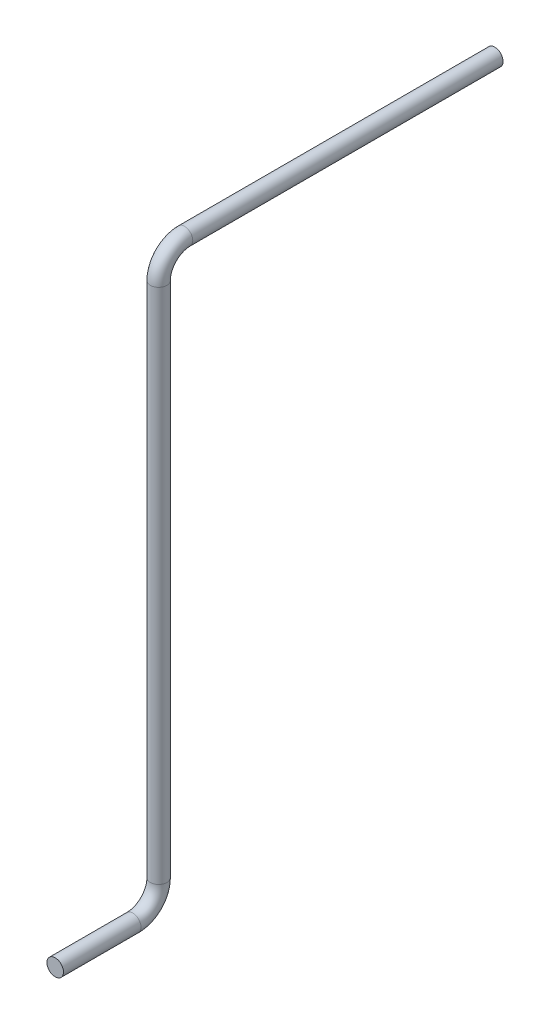
from build123d import *

# Parameters (mm, degrees)
SKETCH1_R = 1.6


with BuildPart() as part:
    # Sweep1: sweep along a path in Sketch2
    with BuildLine(Plane(origin=(0, 0, 0), x_dir=(0, 0, -1), z_dir=(1, 0, 0))) as sweep1_path:
        Line((0, 0), (15, 0))
        ThreePointArc((15, 0), (18.535533906, 1.464466094), (20, 5))
        Line((20, 5), (20, 105))
        ThreePointArc((20, 105), (21.464466094, 108.535533906), (25, 110))
        Line((25, 110), (85, 110))
    # Sketch1 → Sweep1 (sweep)
    with BuildSketch(Plane.XY):
        Circle(SKETCH1_R)
    sweep(path=sweep1_path.line)


solid = part.part
